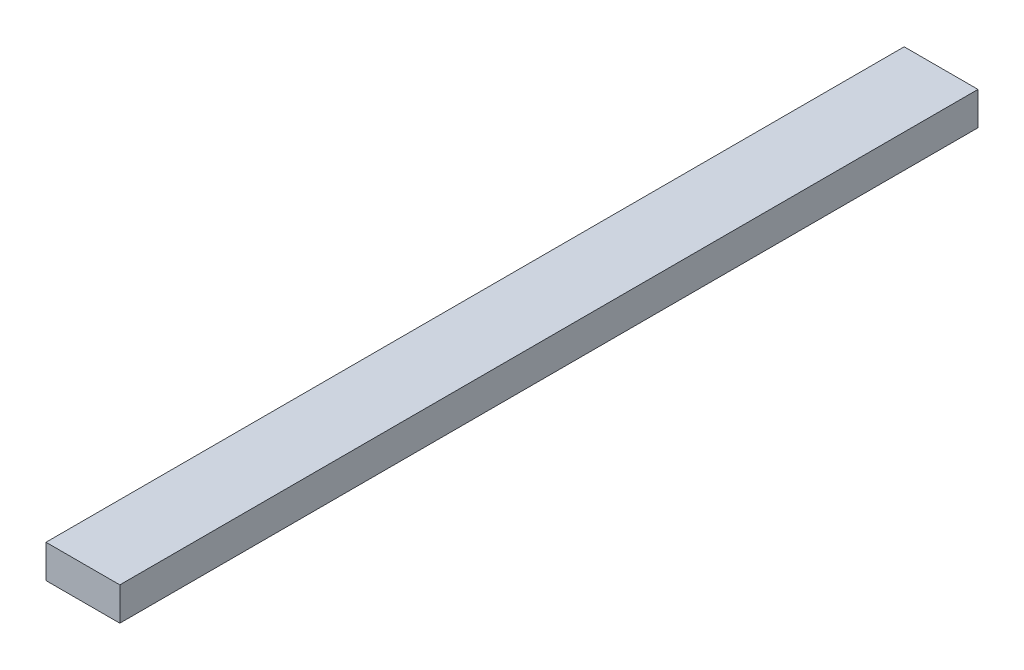
from build123d import *

# Parameters (mm, degrees)
SKETCH1_W           = 40
SKETCH1_H           = 18
BOSS_EXTRUDE1_DEPTH = 465


with BuildPart() as part:
    # Sketch1 → Boss-Extrude1 (new body)
    with BuildSketch(Plane.XY):
        Rectangle(SKETCH1_W, SKETCH1_H)
    extrude(amount=BOSS_EXTRUDE1_DEPTH)


solid = part.part
